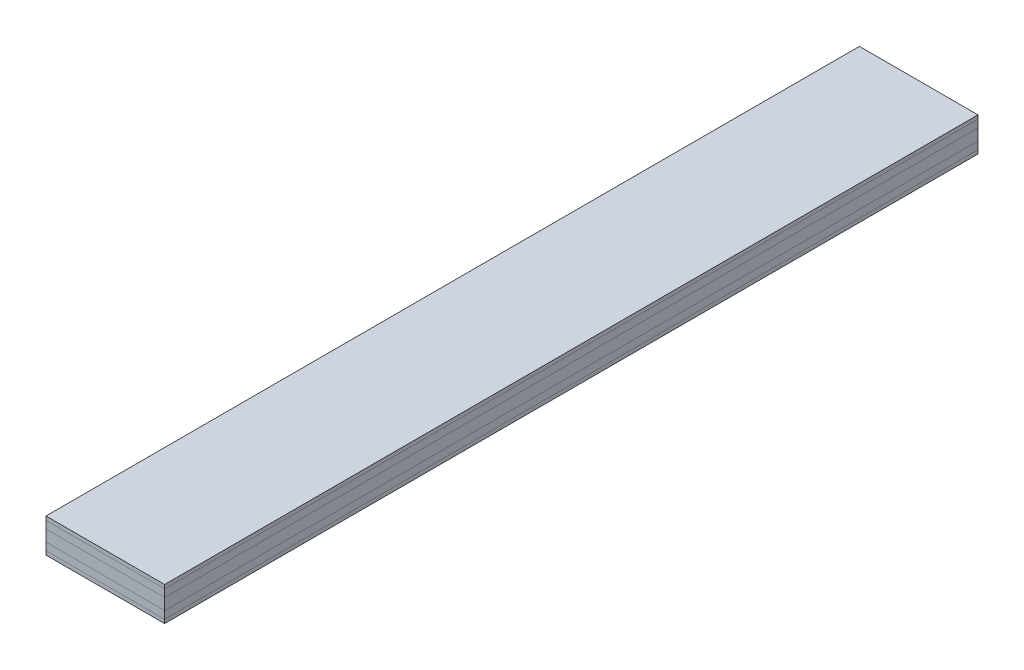
from build123d import *

# Parameters (mm, degrees)
SKETCH3_W                = 609.6
SKETCH3_H                = 1219.2
BOSS_EXTRUDE1_DEPTH      = 25.4
SPLIT1_SURFACE_1_1_BACK  = 1364.344
SPLIT1_SURFACE_1_1_DEPTH = 2728.688
SPLIT1_SURFACE_1_2_BACK  = 1364.344
SPLIT1_SURFACE_1_2_DEPTH = 2728.688
SPLIT1_SURFACE_2_3_BACK  = 1364.344
SPLIT1_SURFACE_2_3_DEPTH = 2728.688
SPLIT1_SURFACE_2_4_BACK  = 1364.344
SPLIT1_SURFACE_2_4_DEPTH = 2728.688
SPLIT1_SURFACE_3_5_BACK  = 1364.344
SPLIT1_SURFACE_3_5_DEPTH = 2728.688
SPLIT1_SURFACE_3_6_BACK  = 1364.344
SPLIT1_SURFACE_3_6_DEPTH = 2728.688
SPLIT1_SURFACE_4_7_BACK  = 1364.344
SPLIT1_SURFACE_4_7_DEPTH = 2728.688
SPLIT1_SURFACE_4_8_BACK  = 1364.344
SPLIT1_SURFACE_4_8_DEPTH = 2728.688
CUT_EXTRUDE1_DEPTH       = 25.4


with BuildPart() as part:
    # Sketch3 → Boss-Extrude1 (new body)
    with BuildSketch(Plane(origin=(0, 0, 0), x_dir=(1, 0, 0), z_dir=(0, 1, 0))):
        Rectangle(SKETCH3_W, SKETCH3_H)
    extrude(amount=-BOSS_EXTRUDE1_DEPTH)


with BuildPart() as body_2:
    # Split1: the piece behind the surface
    add(part.part)
    # Split1 surface 1: a surface, the sketch's curves swept straight by 2728.688 mm
    with BuildLine(Plane.XY.offset(-SPLIT1_SURFACE_1_1_BACK), mode=Mode.PRIVATE) as split1_surface_1_1_path:
        Line((-335.28, -22.577777778), (335.28, -22.577777778))
    split1_surface_1_1 = Shell.extrude(split1_surface_1_1_path.wire(), (0 * SPLIT1_SURFACE_1_1_DEPTH, 0 * SPLIT1_SURFACE_1_1_DEPTH, 1 * SPLIT1_SURFACE_1_1_DEPTH))
    split(bisect_by=split1_surface_1_1, keep=Keep.BOTTOM)


with BuildPart() as part_1:
    add(part.part)

    # Split1: split by a surface, the side it looks to stays
    # Split1 surface 1: a surface, the sketch's curves swept straight by 2728.688 mm
    with BuildLine(Plane.XY.offset(-SPLIT1_SURFACE_1_2_BACK), mode=Mode.PRIVATE) as split1_surface_1_2_path:
        Line((-335.28, -22.577777778), (335.28, -22.577777778))
    split1_surface_1_2 = Shell.extrude(split1_surface_1_2_path.wire(), (0 * SPLIT1_SURFACE_1_2_DEPTH, 0 * SPLIT1_SURFACE_1_2_DEPTH, 1 * SPLIT1_SURFACE_1_2_DEPTH))
    split(bisect_by=split1_surface_1_2, keep=Keep.TOP)


with BuildPart() as body_3:
    # Split1 2: the piece behind the surface
    add(part_1.part)
    # Split1 surface 2: a surface, the sketch's curves swept straight by 2728.688 mm
    with BuildLine(Plane.XY.offset(-SPLIT1_SURFACE_2_3_BACK), mode=Mode.PRIVATE) as split1_surface_2_3_path:
        Line((-335.28, -16.933333333), (335.28, -16.933333333))
    split1_surface_2_3 = Shell.extrude(split1_surface_2_3_path.wire(), (0 * SPLIT1_SURFACE_2_3_DEPTH, 0 * SPLIT1_SURFACE_2_3_DEPTH, 1 * SPLIT1_SURFACE_2_3_DEPTH))
    split(bisect_by=split1_surface_2_3, keep=Keep.BOTTOM)


with BuildPart() as part_2:
    add(part_1.part)

    # Split1 2: split by a surface, the side it looks to stays
    # Split1 surface 2: a surface, the sketch's curves swept straight by 2728.688 mm
    with BuildLine(Plane.XY.offset(-SPLIT1_SURFACE_2_4_BACK), mode=Mode.PRIVATE) as split1_surface_2_4_path:
        Line((-335.28, -16.933333333), (335.28, -16.933333333))
    split1_surface_2_4 = Shell.extrude(split1_surface_2_4_path.wire(), (0 * SPLIT1_SURFACE_2_4_DEPTH, 0 * SPLIT1_SURFACE_2_4_DEPTH, 1 * SPLIT1_SURFACE_2_4_DEPTH))
    split(bisect_by=split1_surface_2_4, keep=Keep.TOP)


with BuildPart() as body_4_2:
    # Split1 3: the piece behind the surface
    add(part_2.part)
    # Split1 surface 3: a surface, the sketch's curves swept straight by 2728.688 mm
    with BuildLine(Plane.XY.offset(-SPLIT1_SURFACE_3_5_BACK), mode=Mode.PRIVATE) as split1_surface_3_5_path:
        Line((-335.28, -2.822222222), (335.28, -2.822222222))
    split1_surface_3_5 = Shell.extrude(split1_surface_3_5_path.wire(), (0 * SPLIT1_SURFACE_3_5_DEPTH, 0 * SPLIT1_SURFACE_3_5_DEPTH, 1 * SPLIT1_SURFACE_3_5_DEPTH))
    split(bisect_by=split1_surface_3_5, keep=Keep.BOTTOM)


with BuildPart() as part_3:
    add(part_2.part)

    # Split1 3: split by a surface, the side it looks to stays
    # Split1 surface 3: a surface, the sketch's curves swept straight by 2728.688 mm
    with BuildLine(Plane.XY.offset(-SPLIT1_SURFACE_3_6_BACK), mode=Mode.PRIVATE) as split1_surface_3_6_path:
        Line((-335.28, -2.822222222), (335.28, -2.822222222))
    split1_surface_3_6 = Shell.extrude(split1_surface_3_6_path.wire(), (0 * SPLIT1_SURFACE_3_6_DEPTH, 0 * SPLIT1_SURFACE_3_6_DEPTH, 1 * SPLIT1_SURFACE_3_6_DEPTH))
    split(bisect_by=split1_surface_3_6, keep=Keep.TOP)


with BuildPart() as body_5_2:
    # Split1 4 body 4 2: the piece behind the surface
    add(body_4_2.part)
    # Split1 surface 4: a surface, the sketch's curves swept straight by 2728.688 mm
    with BuildLine(Plane.XY.offset(-SPLIT1_SURFACE_4_7_BACK), mode=Mode.PRIVATE) as split1_surface_4_7_path:
        Line((-335.28, -8.466666667), (335.28, -8.466666667))
    split1_surface_4_7 = Shell.extrude(split1_surface_4_7_path.wire(), (0 * SPLIT1_SURFACE_4_7_DEPTH, 0 * SPLIT1_SURFACE_4_7_DEPTH, 1 * SPLIT1_SURFACE_4_7_DEPTH))
    split(bisect_by=split1_surface_4_7, keep=Keep.BOTTOM)


with BuildPart() as body_4_2_1:
    add(body_4_2.part)

    # Split1 4 body 4 2: split by a surface, the side it looks to stays
    # Split1 surface 4: a surface, the sketch's curves swept straight by 2728.688 mm
    with BuildLine(Plane.XY.offset(-SPLIT1_SURFACE_4_8_BACK), mode=Mode.PRIVATE) as split1_surface_4_8_path:
        Line((-335.28, -8.466666667), (335.28, -8.466666667))
    split1_surface_4_8 = Shell.extrude(split1_surface_4_8_path.wire(), (0 * SPLIT1_SURFACE_4_8_DEPTH, 0 * SPLIT1_SURFACE_4_8_DEPTH, 1 * SPLIT1_SURFACE_4_8_DEPTH))
    split(bisect_by=split1_surface_4_8, keep=Keep.TOP)


with BuildPart() as cut_extrude1_tool:
    # Sketch6 → Cut-Extrude1 (new body)
    with BuildSketch(Plane(origin=(0, 0, 0), x_dir=(1, 0, 0), z_dir=(0, 1, 0))):
        Polygon((-304.8, -609.6), (215.9, -609.6), (215.9, 0), (304.8, 0), (304.8, 609.6), (-304.8, 609.6), align=None)
    extrude(amount=-CUT_EXTRUDE1_DEPTH)


with BuildPart() as part_4:
    add(part_3.part)

    # Cut-Extrude1: cut by cut_extrude1_tool
    add(cut_extrude1_tool.part, mode=Mode.SUBTRACT)


with BuildPart() as body_2_1:
    add(body_2.part)

    # Cut-Extrude1: cut by cut_extrude1_tool
    add(cut_extrude1_tool.part, mode=Mode.SUBTRACT)


with BuildPart() as body_3_1:
    add(body_3.part)

    # Cut-Extrude1: cut by cut_extrude1_tool
    add(cut_extrude1_tool.part, mode=Mode.SUBTRACT)


with BuildPart() as body_4_2_2:
    add(body_4_2_1.part)

    # Cut-Extrude1: cut by cut_extrude1_tool
    add(cut_extrude1_tool.part, mode=Mode.SUBTRACT)


with BuildPart() as body_5_2_1:
    add(body_5_2.part)

    # Cut-Extrude1: cut by cut_extrude1_tool
    add(cut_extrude1_tool.part, mode=Mode.SUBTRACT)


solid = Compound([part_4.part, body_2_1.part, body_3_1.part, body_4_2_2.part, body_5_2_1.part])
